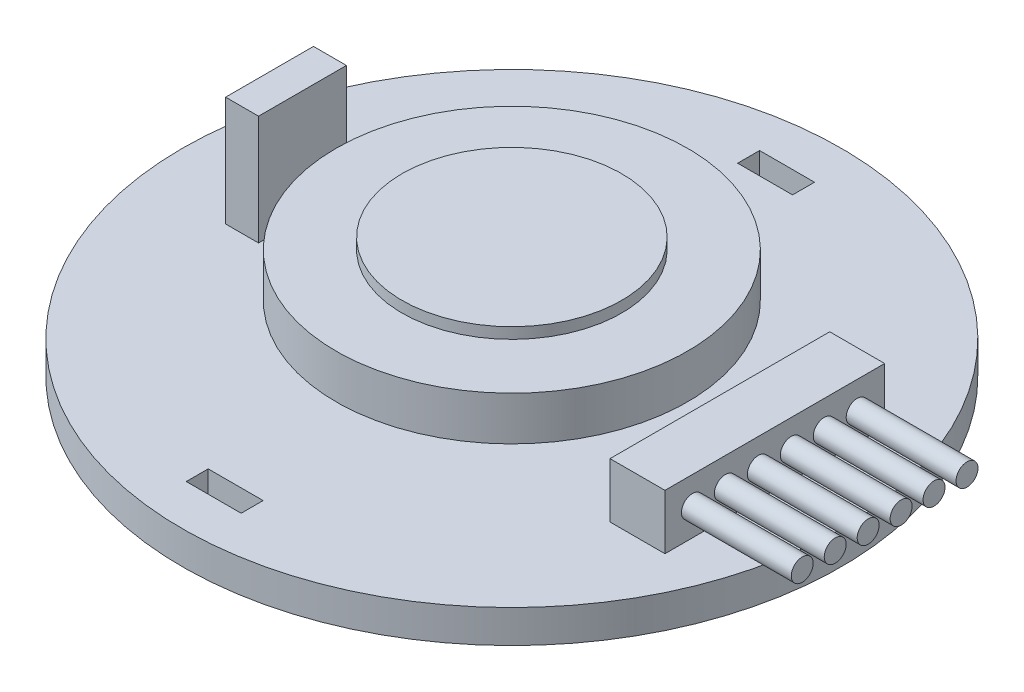
from build123d import *

# Parameters (mm, degrees)
CUT_EXTRUDE1_REACH  = 23.935
SKETCH2_W           = 2.5
SKETCH2_H           = 1
SKETCH3_W           = 1.5
SKETCH3_H           = 4
BOSS_EXTRUDE1_DEPTH = 5
SKETCH3_3_W         = 2.5
SKETCH3_3_H         = 10
BOSS_EXTRUDE2_DEPTH = 2.5
SKETCH5_R           = 0.5
BOSS_EXTRUDE4_DEPTH = 5


with BuildPart() as part:
    # Sketch1 → Revolve1 (revolve)
    with BuildSketch(Plane.XY, mode=Mode.PRIVATE) as revolve1_sk:
        Polygon((0.030129717, -4.421866179), (1.230129717, -4.421866179), (1.230129717, -0.421866179), (15.030129717, -0.421866179), (15.030129717, 1.078133821), (1.230129717, 1.078133821), (1.030129717, 2.078133821), (1.030129717, 2.578133821), (8.030129717, 2.578133821), (8.030129717, 4.578133821), (5.030129717, 4.578133821), (5.030129717, 5.078133821), (0.030129717, 5.078133821), align=None)
    revolve(revolve1_sk.sketch.rotate(Axis((0.030129717, 5.078133821, 0), (0, -1, 0)), 180), axis=Axis((0.030129717, 5.078133821, 0), (0, -1, 0)))

    # Sketch2 → Cut-Extrude1 (cut, up to next)
    with BuildSketch(Plane.XZ.offset(0.421866179), mode=Mode.PRIVATE) as cut_extrude1_sk1:
        with Locations((-0.492014974, -12.55)):
            Rectangle(SKETCH2_W, SKETCH2_H)
    cut_extrude1_tool1 = extrude(cut_extrude1_sk1.sketch, amount=-CUT_EXTRUDE1_REACH, mode=Mode.PRIVATE) & part.part
    # Sketch2 → Cut-Extrude1 (cut, up to next)
    with BuildSketch(Plane.XZ.offset(0.421866179), mode=Mode.PRIVATE) as cut_extrude1_sk2:
        with Locations((-0.492014974, 12.55)):
            Rectangle(SKETCH2_W, SKETCH2_H)
    cut_extrude1_tool2 = extrude(cut_extrude1_sk2.sketch, amount=-CUT_EXTRUDE1_REACH, mode=Mode.PRIVATE) & part.part
    add(cut_extrude1_tool1.solids().sort_by_distance((-0.492015, -0.421866, -12.55))[0], mode=Mode.SUBTRACT)
    add(cut_extrude1_tool2.solids().sort_by_distance((-0.492015, -0.421866, 12.55))[0], mode=Mode.SUBTRACT)

    # Sketch3 → Boss-Extrude1 (add)
    with BuildSketch(Plane(origin=(0, 1.078133821, 0), x_dir=(1, 0, 0), z_dir=(0, 1, 0))):
        with Locations((-10.25, 0)):
            Rectangle(SKETCH3_W, SKETCH3_H)
    extrude(amount=BOSS_EXTRUDE1_DEPTH)

    # Sketch3<3> → Boss-Extrude2 (add)
    with BuildSketch(Plane(origin=(0, 1.078133821, 0), x_dir=(1, 0, 0), z_dir=(0, 1, 0))):
        with Locations((10.75, 0)):
            Rectangle(SKETCH3_3_W, SKETCH3_3_H)
    extrude(amount=BOSS_EXTRUDE2_DEPTH)

    # Sketch5 → Boss-Extrude4 (add)
    with BuildSketch(Plane(origin=(12, 0, 0), x_dir=(0, 0, -1), z_dir=(1, 0, 0))):
        with Locations(Location((-3.75, 2.328133821, 0), (0, 0, 270))):
            Circle(SKETCH5_R)
        with Locations(Location((-2.25, 2.328133821, 0), (0, 0, 270))):
            Circle(SKETCH5_R)
        with Locations(Location((-0.75, 2.328133821, 0), (0, 0, 270))):
            Circle(SKETCH5_R)
        with Locations(Location((0.75, 2.328133821, 0), (0, 0, 270))):
            Circle(SKETCH5_R)
        with Locations(Location((2.25, 2.328133821, 0), (0, 0, 270))):
            Circle(SKETCH5_R)
        with Locations(Location((3.75, 2.328133821, 0), (0, 0, 270))):
            Circle(SKETCH5_R)
    extrude(amount=BOSS_EXTRUDE4_DEPTH)


solid = part.part
